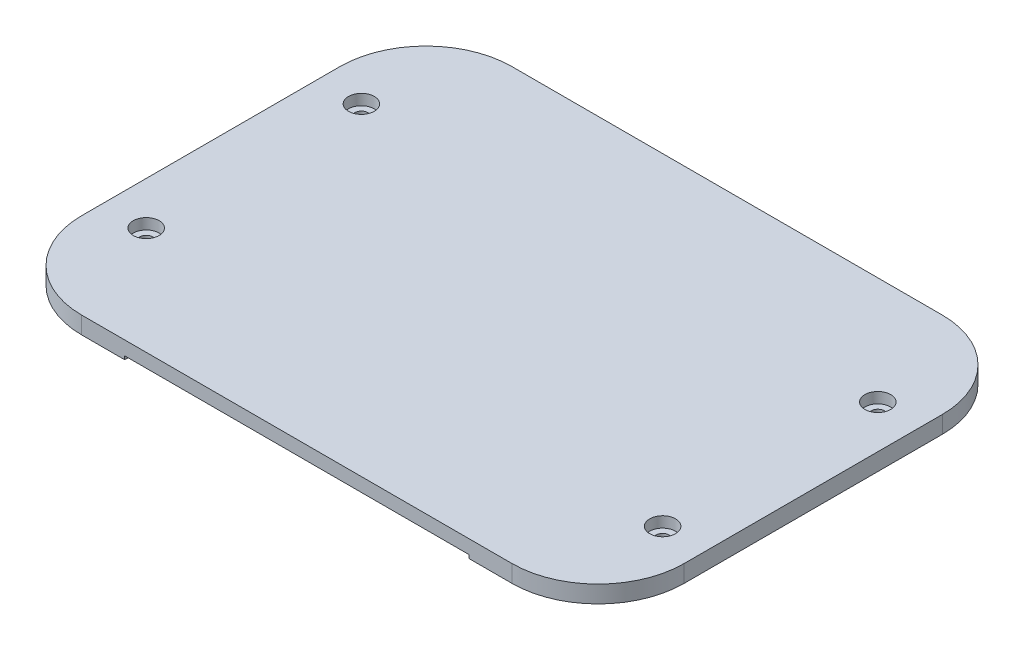
from build123d import *

# Parameters (mm, degrees)
SKETCH_2_W          = 140
SKETCH_2_H          = 100
SKETCH_2_R          = 1.5
EXTRUDE_1_DEPTH     = 5
FILLET_1_R          = 20
SKETCH_3_R          = 3
CUT_EXTRUDE_1_DEPTH = 3
CUT_EXTRUDE_2_DEPTH = 0.9
SKETCH_5_R          = 2.5
CUT_EXTRUDE_3_DEPTH = 4
SKETCH_6_W          = 157.651833544
SKETCH_6_H          = 102.032930916
CUT_EXTRUDE_4_DEPTH = 1
EXTRUDE_START       = -1
SKETCH_7_R          = 2.5
EXTRUDE_2_DEPTH     = 1
SKETCH_8_R          = 3
CUT_EXTRUDE_5_DEPTH = 0.5
SKETCH_9_R          = 5.1
SKETCH_9_R_2        = 4.885066143
CUT_EXTRUDE_6_DEPTH = 3
SKETCH_10_W         = 80
SKETCH_10_H         = 100
EXTRUDE_3_DEPTH     = 0.1


with BuildPart() as part:
    # 草图2 → 凸台-拉伸1 (new body)
    with BuildSketch(Plane(origin=(0, 0, 0), x_dir=(1, 0, 0), z_dir=(0, 1, 0))):
        with Locations((70, -50)):
            Rectangle(SKETCH_2_W, SKETCH_2_H)
        with Locations(Location((10, -25, 0), (0, 0, 270))):
            Circle(SKETCH_2_R, mode=Mode.SUBTRACT)
        with Locations(Location((10, -75, 0), (0, 0, 270))):
            Circle(SKETCH_2_R, mode=Mode.SUBTRACT)
        with Locations(Location((130, -75, 0), (0, 0, 270))):
            Circle(SKETCH_2_R, mode=Mode.SUBTRACT)
        with Locations(Location((130, -25, 0), (0, 0, 270))):
            Circle(SKETCH_2_R, mode=Mode.SUBTRACT)
    extrude(amount=EXTRUDE_1_DEPTH)

    # 圆角1
    fillet_1_edges = [part.edges().sort_by_distance(p)[0] for p in [
        (140, 2.5, 100),
        (0, 2.5, 100),
        (0, 2.5, 0),
        (140, 2.5, 0),
    ]]
    fillet(fillet_1_edges, radius=FILLET_1_R)

    # 草图3 → 切除-拉伸1 (cut)
    with BuildSketch(Plane(origin=(0, 5, 0), x_dir=(1, 0, 0), z_dir=(0, 1, 0))):
        with Locations(Location((10, -25, 0), (0, 0, 270))):
            Circle(SKETCH_3_R)
        with Locations(Location((10, -75, 0), (0, 0, 270))):
            Circle(SKETCH_3_R)
        with Locations(Location((130, -25, 0), (0, 0, 270))):
            Circle(SKETCH_3_R)
        with Locations(Location((130, -75, 0), (0, 0, 270))):
            Circle(SKETCH_3_R)
    extrude(amount=-CUT_EXTRUDE_1_DEPTH, mode=Mode.SUBTRACT)

    # 草图4 → 切除-拉伸2 (cut)
    with BuildSketch(Plane.XZ):
        Polygon((30, 100), (110, 100), (110, 50), (110, 0), (30, 0), (30, 50), align=None)
    extrude(amount=-CUT_EXTRUDE_2_DEPTH, mode=Mode.SUBTRACT)

    # 草图5 → 切除-拉伸3 (cut)
    with BuildSketch(Plane.XZ):
        with Locations(Location((20, 90, 0), (0, 0, 270))):
            Circle(SKETCH_5_R)
        with Locations(Location((120, 90, 0), (0, 0, 270))):
            Circle(SKETCH_5_R)
        with Locations(Location((120, 10, 0), (0, 0, 270))):
            Circle(SKETCH_5_R)
        with Locations(Location((20, 10, 0), (0, 0, 270))):
            Circle(SKETCH_5_R)
    extrude(amount=-CUT_EXTRUDE_3_DEPTH, mode=Mode.SUBTRACT)

    # 草图6 → 切除-拉伸4 (cut)
    with BuildSketch(Plane(origin=(0, 5, 0), x_dir=(1, 0, 0), z_dir=(0, 1, 0))):
        with Locations((78.825916772, -51.016465458)):
            Rectangle(SKETCH_6_W, SKETCH_6_H)
    extrude(amount=-CUT_EXTRUDE_4_DEPTH, mode=Mode.SUBTRACT)

    # 草图7 → 凸台-拉伸2 (add)
    with BuildSketch(Plane(origin=(0, 4, 0), x_dir=(1, 0, 0), z_dir=(0, 1, 0)).offset(EXTRUDE_START)):
        with Locations(Location((20, -10, 0), (0, 0, 90))):
            Circle(SKETCH_7_R)
        with Locations(Location((120, -10, 0), (0, 0, 90))):
            Circle(SKETCH_7_R)
        with Locations(Location((120, -90, 0), (0, 0, 90))):
            Circle(SKETCH_7_R)
        with Locations(Location((20, -90, 0), (0, 0, 90))):
            Circle(SKETCH_7_R)
    extrude(amount=EXTRUDE_2_DEPTH)

    # 草图8 → 切除-拉伸5 (cut)
    with BuildSketch(Plane(origin=(0, 2, 0), x_dir=(1, 0, 0), z_dir=(0, 1, 0))):
        with Locations(Location((10, -25, 0), (0, 0, 270))):
            Circle(SKETCH_8_R)
        with Locations(Location((10, -75, 0), (0, 0, 270))):
            Circle(SKETCH_8_R)
        with Locations(Location((130, -75, 0), (0, 0, 270))):
            Circle(SKETCH_8_R)
        with Locations(Location((130, -25, 0), (0, 0, 270))):
            Circle(SKETCH_8_R)
    extrude(amount=-CUT_EXTRUDE_5_DEPTH, mode=Mode.SUBTRACT)

    # 草图9 → 切除-拉伸6 (cut)
    with BuildSketch(Plane.XZ):
        with Locations(Location((20, 90, 0), (0, 0, 270))):
            Circle(SKETCH_9_R)
        with Locations(Location((120, 90, 0), (0, 0, 270))):
            Circle(SKETCH_9_R)
        with Locations(Location((20, 10, 0), (0, 0, 270))):
            Circle(SKETCH_9_R_2)
        with Locations(Location((120, 10, 0), (0, 0, 270))):
            Circle(SKETCH_9_R)
    extrude(amount=-CUT_EXTRUDE_6_DEPTH, mode=Mode.SUBTRACT)

    # 草图10 → 凸台-拉伸3 (add)
    with BuildSketch(Plane.XZ.offset(-0.9)):
        with Locations((70, 50)):
            Rectangle(SKETCH_10_W, SKETCH_10_H)
    extrude(amount=EXTRUDE_3_DEPTH)


solid = part.part
